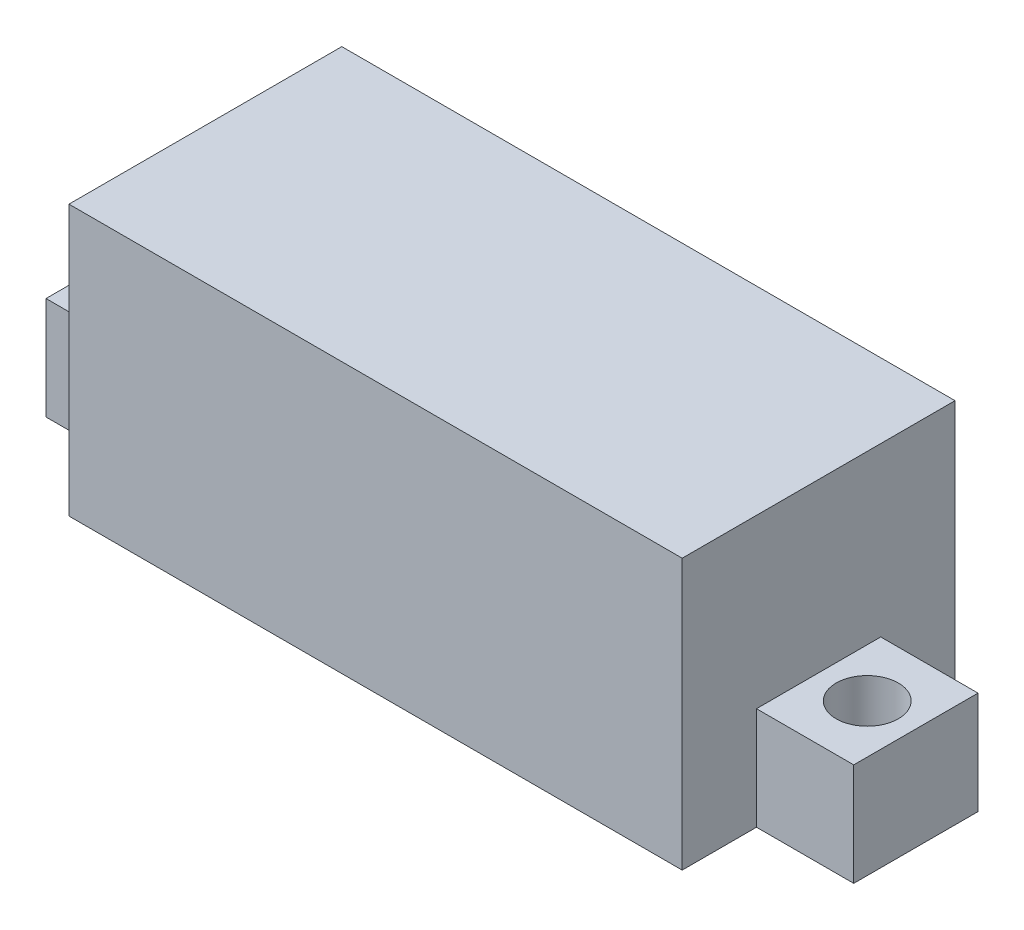
from build123d import *

# Parameters (mm, degrees)
SKETCH_1_W      = 22.7
SKETCH_1_H      = 10.1
EXTRUDE_1_DEPTH = 10
SKETCH_2_W      = 3.6
SKETCH_2_H      = 4.6
SKETCH_2_R      = 1.15
EXTRUDE_2_DEPTH = 3.8


with BuildPart() as part:
    # ｽｹｯﾁ1 → ﾎﾞｽ - 押し出し1 (new body)
    with BuildSketch(Plane(origin=(0, 0, 0), x_dir=(1, 0, 0), z_dir=(0, 1, 0))):
        with Locations((11.35, 5.05)):
            Rectangle(SKETCH_1_W, SKETCH_1_H)
    extrude(amount=EXTRUDE_1_DEPTH)

    # ｽｹｯﾁ2 → ﾎﾞｽ - 押し出し2 (add)
    # profile 1 of 2: a face of its own
    with BuildSketch(Plane.XZ):
        with Locations((-1.8, -5.05)):
            Rectangle(SKETCH_2_W, SKETCH_2_H)
        with Locations(Location((-1.8, -5.05, 0), (0, 0, 270))):
            Circle(SKETCH_2_R, mode=Mode.SUBTRACT)
    # profile 2 of 2: a face of its own
    with BuildSketch(Plane.XZ):
        with Locations((24.5, -5.05)):
            Rectangle(SKETCH_2_W, SKETCH_2_H)
        with Locations(Location((24.5, -5.05, 0), (0, 0, 270))):
            Circle(SKETCH_2_R, mode=Mode.SUBTRACT)
    extrude(amount=-EXTRUDE_2_DEPTH)


solid = part.part
